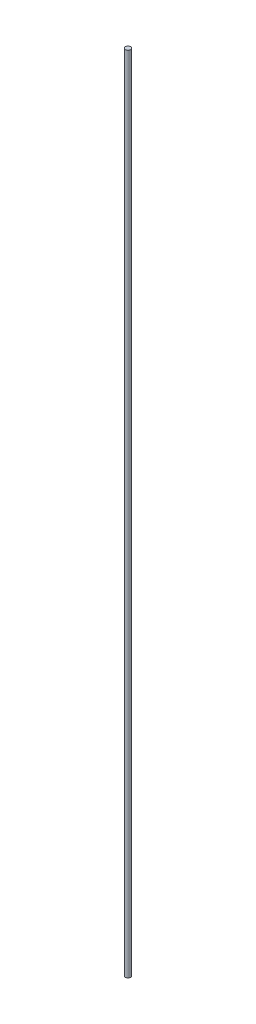
from build123d import *

# Parameters (mm, degrees)
SKETCH1_R           = 3.96875
BOSS_EXTRUDE1_DEPTH = 1219.2


with BuildPart() as part:
    # Sketch1 → Boss-Extrude1 (new body)
    with BuildSketch(Plane(origin=(0, 0, 0), x_dir=(1, 0, 0), z_dir=(0, 1, 0))):
        with Locations(Location((0, 0, 0), (0, 0, 90))):
            Circle(SKETCH1_R)
    extrude(amount=BOSS_EXTRUDE1_DEPTH)


solid = part.part
